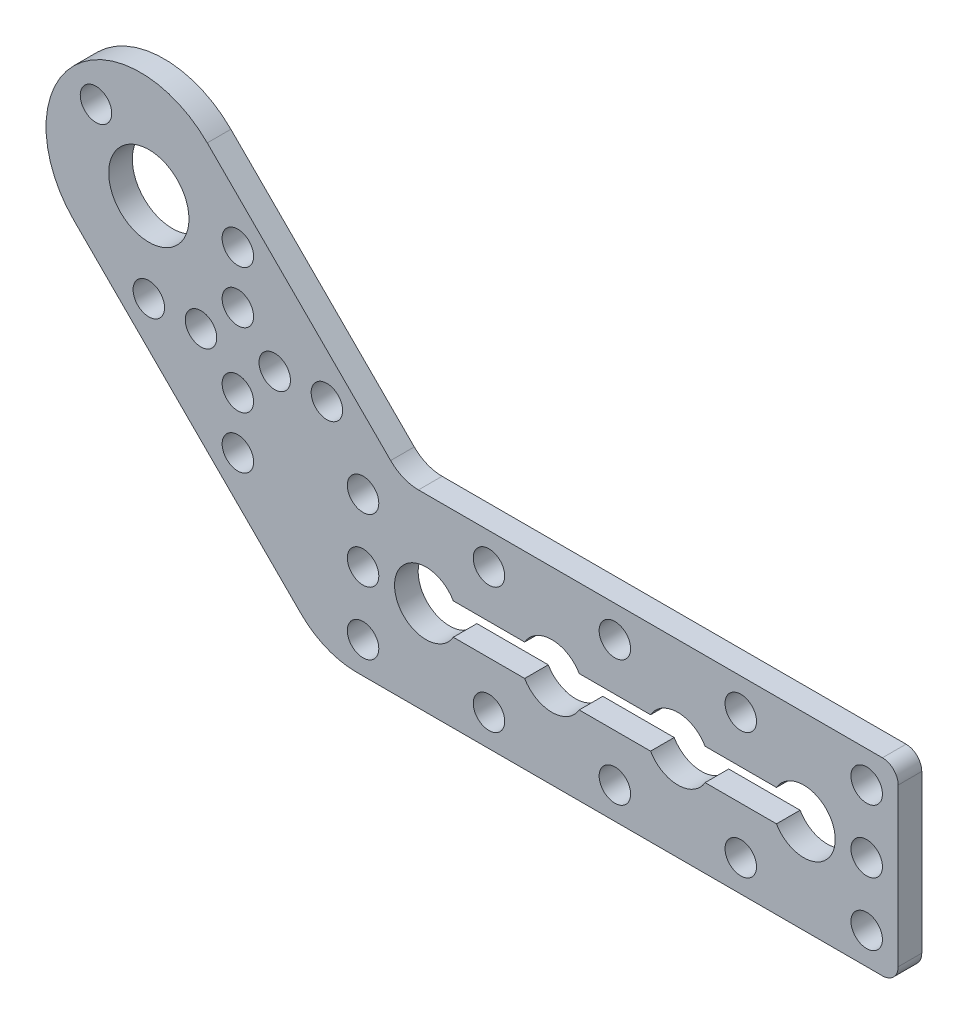
from build123d import *

# Parameters (mm, degrees)
SKETCH_1_R               = 4
EXTRUDE_1_DEPTH          = 3
SKETCH_2_R               = 2
CUT_EXTRUDE_1_DEPTH      = 3
PATTERN_CIRCULAR_1_COUNT = 8
SKETCH_3_R               = 2
CUT_EXTRUDE_2_DEPTH      = 3
PATTERN_LINEAR_1_COUNT   = 3
PATTERN_LINEAR_1_PITCH   = 8
SKETCH_14_W              = 16
SKETCH_14_H              = 4
CUT_EXTRUDE_6_DEPTH      = 3
FILLET_1_R               = 5
FILLET_2_R               = 10
SKETCH_13_R              = 2
CUT_EXTRUDE_5_DEPTH      = 3
SKETCH_44_W              = 47.294876162
SKETCH_44_H              = 24
EXTRUDE_2_DEPTH          = 3
SKETCH_45_R              = 2
CUT_EXTRUDE_18_DEPTH     = 10
PATTERN_LINEAR_2_COUNT   = 6
PATTERN_LINEAR_2_PITCH   = 8
SKETCH_47_R              = 2
CUT_EXTRUDE_19_DEPTH     = 10
FILLET_11_R              = 2
SKETCH_48_R              = 2
CUT_EXTRUDE_20_DEPTH     = 10
SKETCH_66_R              = 3.227064369
EXTRUDE_6_DEPTH          = 3
SKETCH_67_R              = 2
CUT_EXTRUDE_28_DEPTH     = 10
EXTRUDE_7_DEPTH          = 3
SKETCH_71_R              = 2.896747876
EXTRUDE_8_DEPTH          = 3
SKETCH_77_R              = 2
CUT_EXTRUDE_31_DEPTH     = 10
SKETCH_78_R              = 2
CUT_EXTRUDE_32_DEPTH     = 10
SKETCH_79_R              = 2
CUT_EXTRUDE_33_DEPTH     = 10
SKETCH_80_R              = 2
SKETCH_80_R_2            = 4
CUT_EXTRUDE_34_DEPTH     = 10
CUT_EXTRUDE_35_DEPTH     = 10
SKETCH_82_R              = 2
SKETCH_82_R_2            = 4
EXTRUDE_9_DEPTH          = 3
SKETCH_84_R              = 5.1
SKETCH_84_R_2            = 2
CUT_EXTRUDE_36_DEPTH     = 10
SKETCH_88_W              = 16.035160194
SKETCH_88_H              = 32.129057239
CUT_EXTRUDE_38_DEPTH     = 10
FILLET_12_R              = 2
SKETCH_89_R              = 2
CUT_EXTRUDE_39_DEPTH     = 3
SKETCH_90_R              = 2
CUT_EXTRUDE_40_DEPTH     = 10
SKETCH_91_R              = 4
CUT_EXTRUDE_41_DEPTH     = 10
SKETCH_92_R              = 2
CUT_EXTRUDE_42_DEPTH     = 10
PATTERN_LINEAR_3_COUNT   = 3
PATTERN_LINEAR_3_PITCH   = 16
PATTERN_LINEAR_4_COUNT   = 4
PATTERN_LINEAR_4_PITCH   = 16
SKETCH_93_W              = 47.126150853
SKETCH_93_H              = 4
CUT_EXTRUDE_43_DEPTH     = 10
SKETCH_107_R             = 2
CUT_EXTRUDE_46_DEPTH     = 10


with BuildPart() as part:
    # 草图1 → 凸台-拉伸1 (new body)
    with BuildSketch(Plane.XY):
        with BuildLine():
            Line((0, 0), (35.029437252, 0))
            ThreePointArc((35.029437252, 0), (47.029437252, -12), (35.029437252, -24))
            Line((35.029437252, -24), (-9.941125497, -24))
            Line((-9.941125497, -24), (0, 0))
        make_face()
        with Locations((35.029437252, -12)):
            Circle(SKETCH_1_R, mode=Mode.SUBTRACT)
    extrude(amount=EXTRUDE_1_DEPTH)

    # 草图2 → 切除-拉伸1 (cut)
    with BuildSketch(Plane.XY.offset(3)):
        with Locations((43.029437252, -12)):
            Circle(SKETCH_2_R)
    cut_extrude_1 = extrude(amount=-CUT_EXTRUDE_1_DEPTH, mode=Mode.SUBTRACT)

    # 阵列(圆周)1: 切除-拉伸1 ×8 about axis
    pattern_circular_1_axis = Axis((35.029437252, -12, 0), (0, 0, 1))
    for i in range(1, PATTERN_CIRCULAR_1_COUNT):
        add(cut_extrude_1.rotate(pattern_circular_1_axis, i * 360 / PATTERN_CIRCULAR_1_COUNT), mode=Mode.SUBTRACT)

    # 草图3 → 切除-拉伸2 (cut)
    with BuildSketch(Plane.XY.offset(3)):
        with Locations((19.029437252, -4)):
            Circle(SKETCH_3_R)
        with Locations((19.029437252, -20)):
            Circle(SKETCH_3_R)
        with Locations((19.029437252, -12)):
            Circle(SKETCH_3_R)
    cut_extrude_2 = extrude(amount=-CUT_EXTRUDE_2_DEPTH, mode=Mode.SUBTRACT)

    # 阵列(线性)1: 切除-拉伸2 ×3
    with Locations(*[(-i * PATTERN_LINEAR_1_PITCH, 0, 0) for i in range(1, PATTERN_LINEAR_1_COUNT)]):
        add(cut_extrude_2, mode=Mode.SUBTRACT)

    # 草图14 → 切除-拉伸6 (cut)
    with BuildSketch(Plane.XY.offset(3)):
        with Locations((11.029437252, -12)):
            Rectangle(SKETCH_14_W, SKETCH_14_H)
    extrude(amount=-CUT_EXTRUDE_6_DEPTH, mode=Mode.SUBTRACT)

    # 镜向2: part across plane


with BuildPart() as part_1:
    add(part.part)
    add(part.part.mirror(Plane(origin=(-9.941125497, -24, 3), x_dir=(0, 0, 1), z_dir=(0.9238795325112868, -0.38268343236508967, 0))))

    # 圆角1
    fillet_1_edges = [part_1.edges().sort_by_distance(p)[0] for p in [
        (0, 0, 1.5),
    ]]
    fillet(fillet_1_edges, radius=FILLET_1_R)

    # 圆角2
    fillet_2_edges = [part_1.edges().sort_by_distance(p)[0] for p in [
        (-9.941125497, -24, 1.5),
    ]]
    fillet(fillet_2_edges, radius=FILLET_2_R)

    # 草图13 → 切除-拉伸5 (cut)
    with BuildSketch(Plane.XY.offset(3)):
        with Locations((-4.970562748, -12)):
            Circle(SKETCH_13_R)
    extrude(amount=-CUT_EXTRUDE_5_DEPTH, mode=Mode.SUBTRACT)

    # 草图44 → 凸台-拉伸2 (add)
    with BuildSketch(Plane.XY.offset(3)):
        with Locations((47.381999171, -12)):
            Rectangle(SKETCH_44_W, SKETCH_44_H)
    extrude(amount=-EXTRUDE_2_DEPTH)

    # 草图45 → 切除-拉伸18 (cut)
    with BuildSketch(Plane.XY.offset(3)):
        with Locations((67.029437252, -4)):
            Circle(SKETCH_45_R)
        with Locations((67.029437252, -20)):
            Circle(SKETCH_45_R)
    cut_extrude_18 = extrude(amount=-CUT_EXTRUDE_18_DEPTH, mode=Mode.SUBTRACT)

    # 阵列(线性)2: 切除-拉伸18 ×6
    with Locations(*[(-i * PATTERN_LINEAR_2_PITCH, 0, 0) for i in range(1, PATTERN_LINEAR_2_COUNT)]):
        add(cut_extrude_18, mode=Mode.SUBTRACT)

    # 草图47 → 切除-拉伸19 (cut)
    with BuildSketch(Plane.XY.offset(3)):
        with Locations((67.029437252, -12)):
            Circle(SKETCH_47_R)
        with BuildLine():
            Line((59.029437252, -10), (35.029437252, -10))
            ThreePointArc((35.029437252, -10), (33.029437252, -12), (35.029437252, -14))
            Line((35.029437252, -14), (59.029437252, -14))
            ThreePointArc((59.029437252, -14), (61.029437252, -12), (59.029437252, -10))
        make_face()
        with BuildLine():
            Line((17.062680891, -10), (17.062680891, -14))
            Line((17.062680891, -14), (27.029437252, -14))
            ThreePointArc((27.029437252, -14), (29.029437252, -12), (27.029437252, -10))
            Line((27.029437252, -10), (17.062680891, -10))
        make_face()
    extrude(amount=-CUT_EXTRUDE_19_DEPTH, mode=Mode.SUBTRACT)

    # 圆角11
    fillet_11_edges = [part_1.edges().sort_by_distance(p)[0] for p in [
        (71.029437252, 0, 1.5),
        (71.029437252, -24, 1.5),
    ]]
    fillet(fillet_11_edges, radius=FILLET_11_R)

    # 草图48 → 切除-拉伸20 (cut)
    with BuildSketch(Plane.XY.offset(3)):
        with Locations((-4.970562748, -20)):
            Circle(SKETCH_48_R)
        with Locations((-10.627416998, -17.656854249)):
            Circle(SKETCH_48_R)
    extrude(amount=-CUT_EXTRUDE_20_DEPTH, mode=Mode.SUBTRACT)

    # 草图66 → 凸台-拉伸6 (add)
    with BuildSketch(Plane.XY.offset(3)):
        with Locations((-27.398586608, 0)):
            Circle(SKETCH_66_R)
    extrude(amount=-EXTRUDE_6_DEPTH)

    # 草图67 → 切除-拉伸28 (cut)
    with BuildSketch(Plane.XY.offset(3)):
        with Locations((-25.254833996, 0.284271247)):
            Circle(SKETCH_67_R)
    extrude(amount=-CUT_EXTRUDE_28_DEPTH, mode=Mode.SUBTRACT)

    # 草图70 → 凸台-拉伸7 (add)
    with BuildSketch(Plane.XY.offset(3)):
        Polygon((-30.596841729, 0), (-25.315891714, -7.21150969), (-15.151482544, -16.524152728), (-1.274400878, -1.377825788), (-7.279372778, 5.996536758), (-16.546058046, 14.486684154), align=None)
    extrude(amount=-EXTRUDE_7_DEPTH)

    # 草图71 → 凸台-拉伸8 (add)
    with BuildSketch(Plane.XY.offset(3)):
        with Locations((-10.627416998, -17.656854249)):
            Circle(SKETCH_71_R)
    extrude(amount=-EXTRUDE_8_DEPTH)

    # 草图77 → 切除-拉伸31 (cut)
    with BuildSketch(Plane.XY.offset(3)):
        with Locations((-16.284271247, -0.686291501)):
            Circle(SKETCH_77_R)
    extrude(amount=-CUT_EXTRUDE_31_DEPTH, mode=Mode.SUBTRACT)

    # 草图78 → 切除-拉伸32 (cut)
    with BuildSketch(Plane.XY.offset(3)):
        with Locations((-21.941125497, 4.970562748)):
            Circle(SKETCH_78_R)
    extrude(amount=-CUT_EXTRUDE_32_DEPTH, mode=Mode.SUBTRACT)

    # 草图79 → 切除-拉伸33 (cut)
    with BuildSketch(Plane.XY.offset(3)):
        with Locations((-10.627416998, -6.343145751)):
            Circle(SKETCH_79_R)
    extrude(amount=-CUT_EXTRUDE_33_DEPTH, mode=Mode.SUBTRACT)

    # 草图80 → 切除-拉伸34 (cut)
    with BuildSketch(Plane.XY.offset(3)):
        with Locations((-25.254833996, 0.284271247)):
            Circle(SKETCH_80_R)
        with Locations(Location((-33.254833996, 8.284271247, 0), (0, 0, 270))):
            Circle(SKETCH_80_R)
        with Locations(Location((-27.597979746, 10.627416998, 0), (0, 0, 315))):
            Circle(SKETCH_80_R)
        with Locations((-25.254833996, 16.284271247)):
            Circle(SKETCH_80_R)
        with Locations(Location((-27.597979746, 21.941125497, 0), (0, 0, 45))):
            Circle(SKETCH_80_R)
        with Locations(Location((-33.254833996, 24.284271247, 0), (0, 0, 90))):
            Circle(SKETCH_80_R)
        with Locations(Location((-33.254833996, 16.284271247, 0), (0, 0, 135))):
            Circle(SKETCH_80_R_2)
        with Locations(Location((-38.911688245, 21.941125497, 0), (0, 0, 135))):
            Circle(SKETCH_80_R)
        with Locations(Location((-41.254833996, 16.284271247, 0), (0, 0, 180))):
            Circle(SKETCH_80_R)
        with Locations(Location((-38.911688245, 10.627416998, 0), (0, 0, 225))):
            Circle(SKETCH_80_R)
        with Locations((-17.254833996, 8.284271247)):
            Circle(SKETCH_80_R)
        with Locations((-9.254833996, 0.284271247)):
            Circle(SKETCH_80_R)
        with Locations((-17.254833996, -7.715728753)):
            Circle(SKETCH_80_R)
        with Locations((-21.941125497, -6.343145751)):
            Circle(SKETCH_80_R)
        with Locations((-10.627416998, 4.970562748)):
            Circle(SKETCH_80_R)
        with Locations((-10.627416998, -17.656854249)):
            Circle(SKETCH_80_R)
    extrude(amount=-CUT_EXTRUDE_34_DEPTH, mode=Mode.SUBTRACT)

    # 草图81 → 切除-拉伸35 (cut)
    with BuildSketch(Plane.XY.offset(3)):
        with BuildLine():
            Line((-23.355339059, 3.556349186), (-12.04163056, -7.757359313))
            ThreePointArc((-12.04163056, -7.757359313), (-9.213203436, -7.757359313), (-9.213203436, -4.928932188))
            Line((-9.213203436, -4.928932188), (-20.526911935, 6.384776311))
            ThreePointArc((-20.526911935, 6.384776311), (-23.355339059, 6.384776311), (-23.355339059, 3.556349186))
        make_face()
    extrude(amount=-CUT_EXTRUDE_35_DEPTH, mode=Mode.SUBTRACT)

    # 草图82 → 凸台-拉伸9 (add)
    with BuildSketch(Plane.XY.offset(3)):
        with Locations((67.029437252, -4)):
            Circle(SKETCH_82_R)
        with Locations((67.029437252, -12)):
            Circle(SKETCH_82_R)
        with Locations((67.029437252, -20)):
            Circle(SKETCH_82_R)
        with Locations((51.029437252, -20)):
            Circle(SKETCH_82_R)
        with Locations((51.029437252, -4)):
            Circle(SKETCH_82_R)
        with Locations((35.029437252, -4)):
            Circle(SKETCH_82_R)
        with Locations((35.029437252, -20)):
            Circle(SKETCH_82_R)
        with Locations((27.029437252, -20)):
            Circle(SKETCH_82_R)
        with Locations((27.029437252, -4)):
            Circle(SKETCH_82_R)
        with Locations((19.029437252, -4)):
            Circle(SKETCH_82_R)
        with Locations((19.029437252, -20)):
            Circle(SKETCH_82_R)
        with Locations((11.029437252, -20)):
            Circle(SKETCH_82_R)
        with Locations((3.029437252, -20)):
            Circle(SKETCH_82_R)
        with Locations((-4.970562748, -20)):
            Circle(SKETCH_82_R)
        with Locations((-10.627416998, -17.656854249)):
            Circle(SKETCH_82_R)
        with Locations((3.029437252, -4)):
            Circle(SKETCH_82_R)
        with Locations((11.029437252, -4)):
            Circle(SKETCH_82_R)
        with Locations((-33.254833996, 24.284271247)):
            Circle(SKETCH_82_R)
        with Locations((-41.254833996, 16.284271247)):
            Circle(SKETCH_82_R)
        with Locations((-33.254833996, 16.284271247)):
            Circle(SKETCH_82_R_2)
        with Locations((-33.254833996, 8.284271247)):
            Circle(SKETCH_82_R)
        with Locations((-27.597979746, 10.627416998)):
            Circle(SKETCH_82_R)
        with Locations((-25.254833996, 16.284271247)):
            Circle(SKETCH_82_R)
        with Locations((-25.254833996, 0.284271247)):
            Circle(SKETCH_82_R)
        with Locations((-17.254833996, 8.284271247)):
            Circle(SKETCH_82_R)
        with Locations((-17.254833996, -7.715728753)):
            Circle(SKETCH_82_R)
        with Locations((-9.254833996, 0.284271247)):
            Circle(SKETCH_82_R)
        with Locations((-10.627416998, 4.970562748)):
            Circle(SKETCH_82_R)
        with Locations((-21.941125497, -6.343145751)):
            Circle(SKETCH_82_R)
        with Locations((-27.597979746, 21.941125497)):
            Circle(SKETCH_82_R)
        with Locations((-38.911688245, 10.627416998)):
            Circle(SKETCH_82_R)
        with BuildLine():
            Line((-9.213203436, -4.928932188), (-20.526911935, 6.384776311))
            ThreePointArc((-20.526911935, 6.384776311), (-23.355339059, 6.384776311), (-23.355339059, 3.556349186))
            Line((-23.355339059, 3.556349186), (-12.04163056, -7.757359313))
            ThreePointArc((-12.04163056, -7.757359313), (-9.213203436, -7.757359313), (-9.213203436, -4.928932188))
        make_face()
        with BuildLine():
            Line((27.029437252, -10), (3.029437252, -10))
            ThreePointArc((3.029437252, -10), (1.029437252, -12), (3.029437252, -14))
            Line((3.029437252, -14), (27.029437252, -14))
            ThreePointArc((27.029437252, -14), (29.029437252, -12), (27.029437252, -10))
        make_face()
        with BuildLine():
            Line((59.029437252, -10), (35.029437252, -10))
            ThreePointArc((35.029437252, -10), (33.029437252, -12), (35.029437252, -14))
            Line((35.029437252, -14), (59.029437252, -14))
            ThreePointArc((59.029437252, -14), (61.029437252, -12), (59.029437252, -10))
        make_face()
    extrude(amount=-EXTRUDE_9_DEPTH)

    # 草图84 → 切除-拉伸36 (cut)
    with BuildSketch(Plane.XY.offset(3)):
        with Locations((-32.194173824, 15.223611076)):
            Circle(SKETCH_84_R)
        with Locations((-20.880465325, -7.403805922)):
            Circle(SKETCH_84_R_2)
        with Locations((-9.566756826, 3.909902577)):
            Circle(SKETCH_84_R_2)
    extrude(amount=-CUT_EXTRUDE_36_DEPTH, mode=Mode.SUBTRACT)

    # 草图88 → 切除-拉伸38 (cut)
    with BuildSketch(Plane.XY.offset(3)):
        with Locations((71.047017349, -11.636430702)):
            Rectangle(SKETCH_88_W, SKETCH_88_H)
    extrude(amount=-CUT_EXTRUDE_38_DEPTH, mode=Mode.SUBTRACT)

    # 圆角12
    fillet_12_edges = [part_1.edges().sort_by_distance(p)[0] for p in [
        (63.029437252, 0, 1.5),
        (63.029437252, -24, 1.5),
    ]]
    fillet(fillet_12_edges, radius=FILLET_12_R)

    # 草图89 → 切除-拉伸39 (cut)
    with BuildSketch(Plane.XY.offset(3)):
        with Locations((-20.880465325, 15.223611076)):
            Circle(SKETCH_89_R)
        with Locations((-20.880465325, -0.776388924)):
            Circle(SKETCH_89_R)
    cut_extrude_39 = extrude(amount=-CUT_EXTRUDE_39_DEPTH, mode=Mode.SUBTRACT)

    # 镜向3: 切除-拉伸39 across plane
    add(cut_extrude_39.mirror(Plane(origin=(-8.485281374, -8.485281374, 0), x_dir=(0, 0, 1), z_dir=(-0.7071067811865476, -0.7071067811865476, 0))), mode=Mode.SUBTRACT)

    # 草图90 → 切除-拉伸40 (cut)
    with BuildSketch(Plane.XY.offset(3)):
        with Locations((59.029437252, -12)):
            Circle(SKETCH_90_R)
    extrude(amount=-CUT_EXTRUDE_40_DEPTH, mode=Mode.SUBTRACT)

    # 草图91 → 切除-拉伸41 (cut)
    with BuildSketch(Plane.XY.offset(3)):
        with Locations((51.029437252, -12)):
            Circle(SKETCH_91_R)
    cut_extrude_41 = extrude(amount=-CUT_EXTRUDE_41_DEPTH, mode=Mode.SUBTRACT)

    # 草图92 → 切除-拉伸42 (cut)
    with BuildSketch(Plane.XY.offset(3)):
        with Locations((27.029437252, -4)):
            Circle(SKETCH_92_R)
        with Locations((27.029437252, -20)):
            Circle(SKETCH_92_R)
    cut_extrude_42 = extrude(amount=-CUT_EXTRUDE_42_DEPTH, mode=Mode.SUBTRACT)

    # 阵列(线性)3: 切除-拉伸42 ×3
    with Locations(*[(-i * PATTERN_LINEAR_3_PITCH, 0, 0) for i in range(1, PATTERN_LINEAR_3_COUNT)]):
        add(cut_extrude_42, mode=Mode.SUBTRACT)

    # 阵列(线性)4: 切除-拉伸41 ×4
    with Locations(*[(-i * PATTERN_LINEAR_4_PITCH, 0, 0) for i in range(1, PATTERN_LINEAR_4_COUNT)]):
        add(cut_extrude_41, mode=Mode.SUBTRACT)

    # 草图93 → 切除-拉伸43 (cut)
    with BuildSketch(Plane.XY.offset(3)):
        with Locations((26.022808232, -12)):
            Rectangle(SKETCH_93_W, SKETCH_93_H)
    extrude(amount=-CUT_EXTRUDE_43_DEPTH, mode=Mode.SUBTRACT)

    # 草图107 → 切除-拉伸46 (cut)
    with BuildSketch(Plane.XY.offset(3)):
        with Locations((-25.566756826, 3.909902577)):
            Circle(SKETCH_107_R)
        with Locations((-20.880465325, 8.596194078)):
            Circle(SKETCH_107_R)
    extrude(amount=-CUT_EXTRUDE_46_DEPTH, mode=Mode.SUBTRACT)


solid = part_1.part
